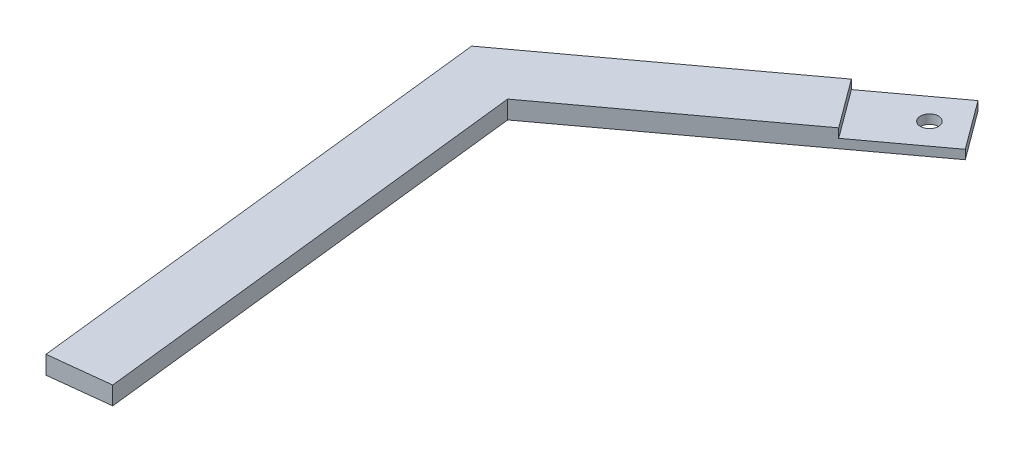
from build123d import *

# Parameters (mm, degrees)
BOSS_EXTRUDE1_DEPTH = 3
CUT_EXTRUDE1_DEPTH  = 1.5
SKETCH3_R           = 1.5
CUT_EXTRUDE2_DEPTH  = 1.5


with BuildPart() as part:
    # Sketch1 → Boss-Extrude1 (new body)
    with BuildSketch(Plane(origin=(0, 0, 0), x_dir=(1, 0, 0), z_dir=(0, 1, 0))):
        Polygon((18.257985868, 29.477662881), (-30.015571152, -6.154677663), (-21.053259688, -85.65107364), (-11.116210191, -84.530784707), (-19.431722538, -10.771546932), (24.196709292, 21.432070044), align=None)
    extrude(amount=BOSS_EXTRUDE1_DEPTH)

    # Sketch2 → Cut-Extrude1 (cut)
    with BuildSketch(Plane(origin=(0, 3, 0), x_dir=(1, 0, 0), z_dir=(0, 1, 0))):
        Polygon((18.257985868, 29.477662881), (24.196709292, 21.432070044), (12.128320037, 12.523984908), (6.189596613, 20.569577745), align=None)
    extrude(amount=-CUT_EXTRUDE1_DEPTH, mode=Mode.SUBTRACT)

    # Sketch3 → Cut-Extrude2 (cut)
    with BuildSketch(Plane(origin=(0, 1.5, 0), x_dir=(1, 0, 0), z_dir=(0, 1, 0))):
        with Locations(Location((17.204551161, 22.485504751, 0), (0, 0, 270))):
            Circle(SKETCH3_R)
    extrude(amount=-CUT_EXTRUDE2_DEPTH, mode=Mode.SUBTRACT)


solid = part.part
